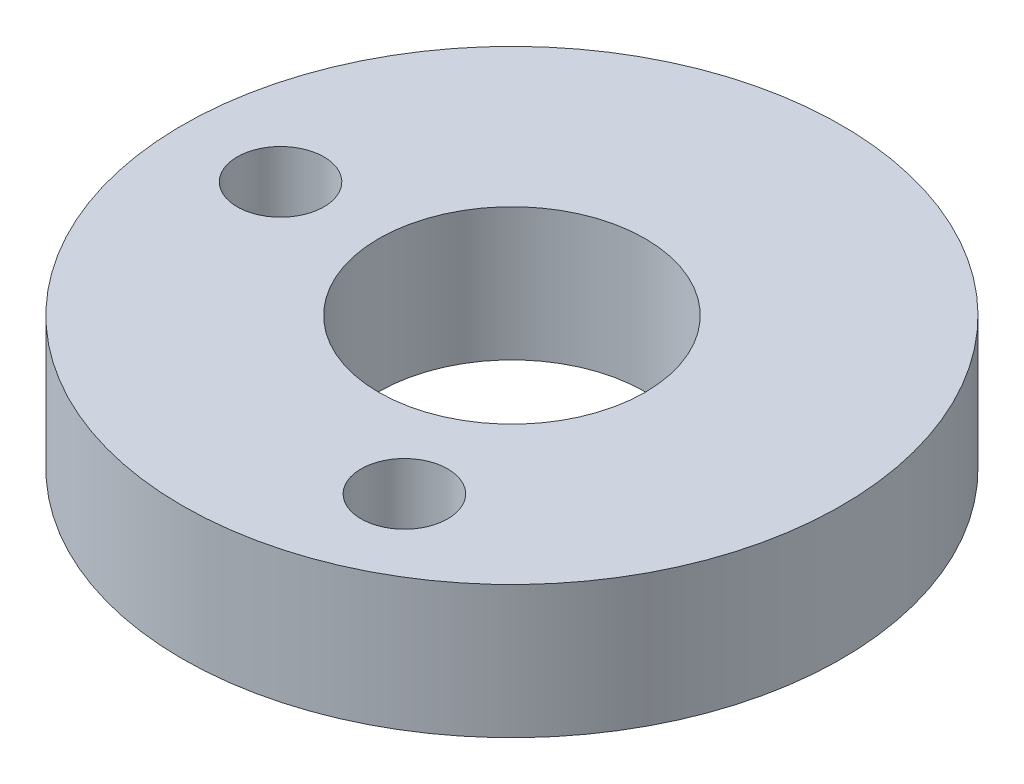
from build123d import *

# Parameters (mm, degrees)
SKETCH1_R           = 31.55
SKETCH1_R_2         = 12.75
BOSS_EXTRUDE1_DEPTH = 12.7
SKETCH2_R           = 4.15
CUT_EXTRUDE1_DEPTH  = 12.7


with BuildPart() as part:
    # Sketch1 → Boss-Extrude1 (new body)
    with BuildSketch(Plane(origin=(0, 0, 0), x_dir=(1, 0, 0), z_dir=(0, 1, 0))):
        with Locations(Location((0, 0, 0), (0, 0, 270))):
            Circle(SKETCH1_R)
        with Locations(Location((0, 0, 0), (0, 0, 270))):
            Circle(SKETCH1_R_2, mode=Mode.SUBTRACT)
    extrude(amount=BOSS_EXTRUDE1_DEPTH)

    # Sketch2 → Cut-Extrude1 (cut)
    with BuildSketch(Plane.XZ):
        with Locations(Location((-22.15, 0, 0), (0, 0, 270))):
            Circle(SKETCH2_R)
        with Locations(Location((9.644602709, 19.940013505, 0), (0, 0, 270))):
            Circle(SKETCH2_R)
    extrude(amount=-CUT_EXTRUDE1_DEPTH, mode=Mode.SUBTRACT)


solid = part.part
